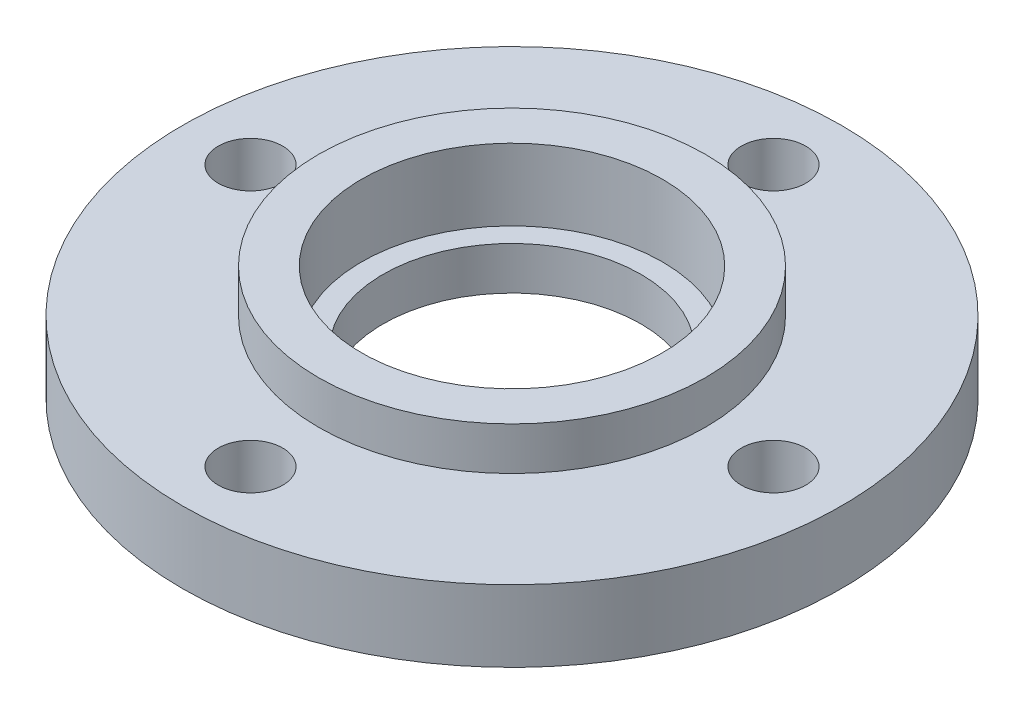
from build123d import *

# Parameters (mm, degrees)
M4_CLEARANCE_HOLE1_D = 4.5
CIRPATTERN1_COUNT    = 4


with BuildPart() as part:
    # Sketch1 → Revolve1 (revolve)
    with BuildSketch(Plane.XY, mode=Mode.PRIVATE) as revolve1_sk:
        Polygon((9, 0), (9, -3), (23, -3), (23, 2), (13.5, 2), (13.5, 5), (10.5, 5), (10.5, 0), align=None)
    revolve(revolve1_sk.sketch.rotate(Axis((0, -55, 0), (0, 1, 0)), 90), axis=Axis((0, -55, 0), (0, 1, 0)))

    # M4 Clearance Hole1 (through all)
    with Locations(Plane(origin=(0, 2, 0), x_dir=(1, 0, 0), z_dir=(0, 1, 0))):
        with Locations((18.25, 0)):
            m4_clearance_hole1 = Hole(M4_CLEARANCE_HOLE1_D / 2)

    # CirPattern1: M4 Clearance Hole1 ×4 about axis
    cirpattern1_axis = Axis((0, 0, 0), (0, 1, 0))
    for i in range(1, CIRPATTERN1_COUNT):
        add(m4_clearance_hole1.rotate(cirpattern1_axis, i * 360 / CIRPATTERN1_COUNT), mode=Mode.SUBTRACT)


solid = part.part
